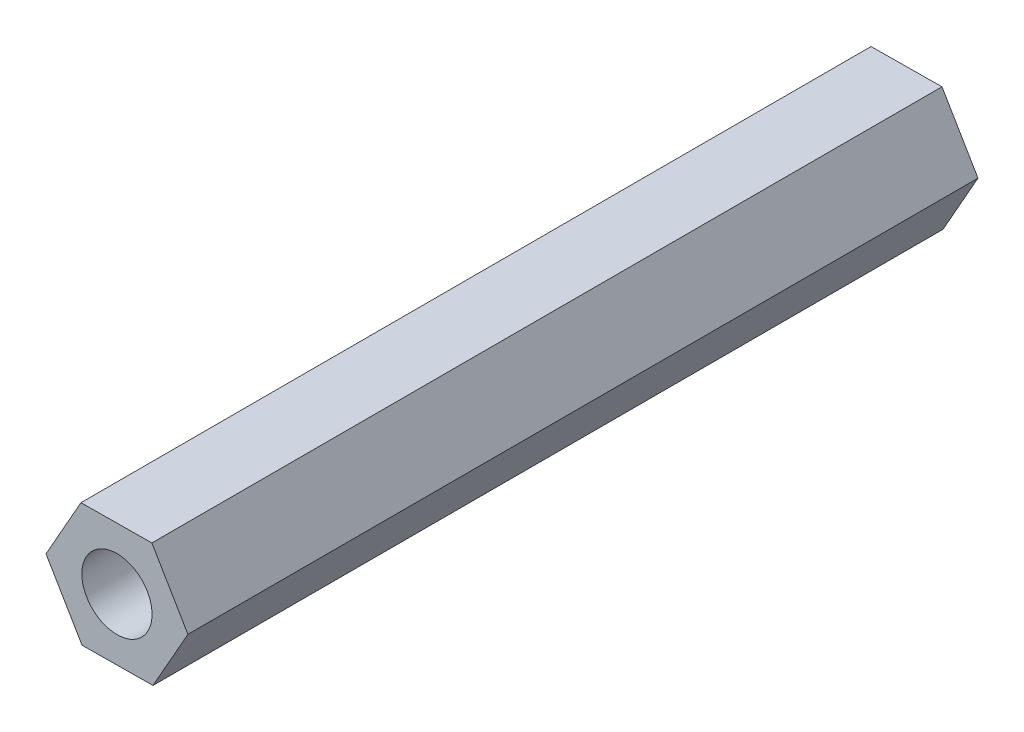
from build123d import *

# Parameters (mm, degrees)
SKETCH_1_R      = 2
EXTRUDE_1_DEPTH = 45


with BuildPart() as part:
    # 草图1 → 凸台-拉伸1 (new body)
    with BuildSketch(Plane.XY):
        Polygon((2.051456248, -3.482077052), (4.041295309, 0.035574699), (1.989839061, 3.517651751), (-2.051456248, 3.482077052), (-4.041295309, -0.035574699), (-1.989839061, -3.517651751), align=None)
        with Locations(Location((0, 0, 0), (0, 0, 180))):
            Circle(SKETCH_1_R, mode=Mode.SUBTRACT)
    extrude(amount=EXTRUDE_1_DEPTH)


solid = part.part
